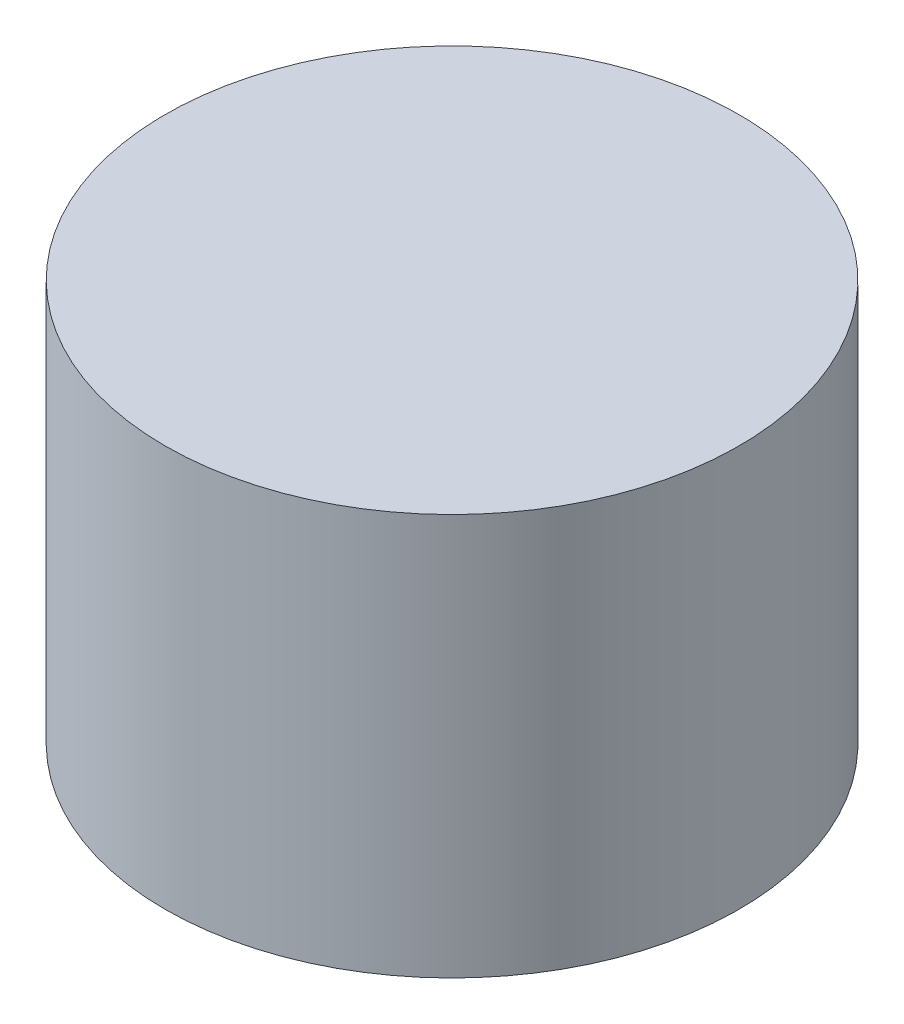
from build123d import *

# Parameters (mm, degrees)
SKETCH2_R           = 7.15
BOSS_EXTRUDE1_DEPTH = 10


with BuildPart() as part:
    # Sketch2 → Boss-Extrude1 (new body)
    with BuildSketch(Plane(origin=(0, 0, 0), x_dir=(1, 0, 0), z_dir=(0, 1, 0))):
        with Locations(Location((0, 0, 0), (0, 0, 270))):
            Circle(SKETCH2_R)
    extrude(amount=BOSS_EXTRUDE1_DEPTH)


solid = part.part
